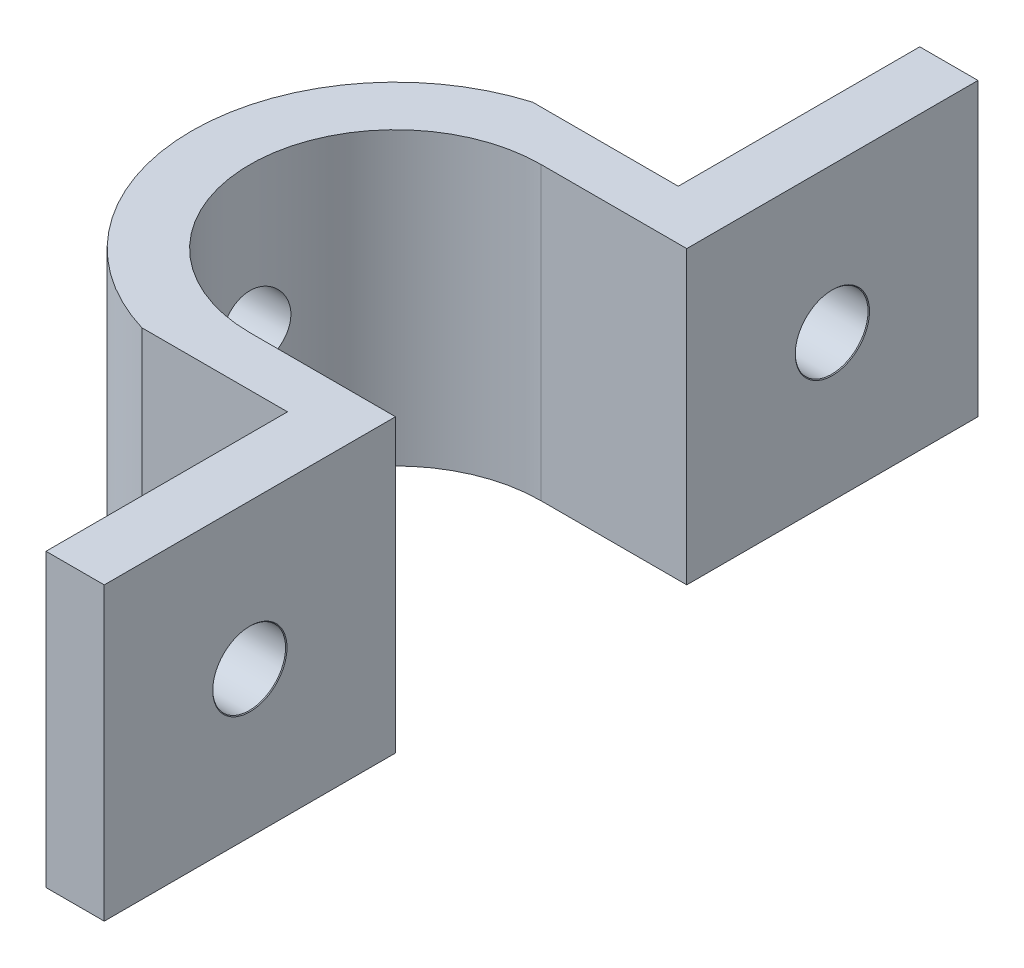
from build123d import *

# Parameters (mm, degrees)
EXTRUDE_1_DEPTH              = 10
HOLE_WIZARD_M3_2_D           = 2.5
HOLE_WIZARD_M3_2_CSINK_D     = 2.55
HOLE_WIZARD_M3_2_CSINK_ANGLE = 90
SKETCH_15_W                  = 10
SKETCH_15_H                  = 10
EXTRUDE_2_DEPTH              = 5
HOLE_WIZARD_M3_1_D           = 2.5
HOLE_WIZARD_M3_1_CSINK_D     = 2.55
HOLE_WIZARD_M3_1_CSINK_ANGLE = 90
SKETCH_21_W                  = 8.291796068
SKETCH_21_H                  = 10
CUT_EXTRUDE_2_DEPTH          = 5


with BuildPart() as part:
    # 草图1 → 凸台-拉伸1 (new body)
    with BuildSketch(Plane(origin=(0, 0, 0), x_dir=(1, 0, 0), z_dir=(0, 1, 0))):
        with BuildLine():
            Line((0, 0), (0, -10))
            ThreePointArc((0, -10), (-5, -15), (0, -20))
            Line((0, -20), (0, -30))
            Line((0, -30), (-2, -30))
            Line((-2, -30), (-2, -21.708203932))
            ThreePointArc((-2, -21.708203932), (-7, -15), (-2, -8.291796068))
            Line((-2, -8.291796068), (-2, 0))
            Line((-2, 0), (0, 0))
        make_face()
    extrude(amount=EXTRUDE_1_DEPTH)

    # M3 螺纹孔的螺纹孔钻头2 (through all)
    with Locations(Plane.ZY.offset(7)):
        with Locations((15, 5)):
            CounterSinkHole(HOLE_WIZARD_M3_2_D / 2, HOLE_WIZARD_M3_2_CSINK_D / 2, counter_sink_angle=HOLE_WIZARD_M3_2_CSINK_ANGLE)

    # 草图15 → 凸台-拉伸2 (add)
    with BuildSketch(Plane(origin=(0, 0, 0), x_dir=(0, 0, -1), z_dir=(1, 0, 0))):
        with Locations((-5, 5)):
            Rectangle(SKETCH_15_W, SKETCH_15_H)
        with Locations((-25, 5)):
            Rectangle(SKETCH_15_W, SKETCH_15_H)
    extrude(amount=EXTRUDE_2_DEPTH)

    # M3 螺纹孔的螺纹孔钻头1 (through all)
    with Locations(Plane(origin=(5, 0, 0), x_dir=(0, 0, -1), z_dir=(1, 0, 0))):
        with Locations((-5, 5), (-25, 5)):
            CounterSinkHole(HOLE_WIZARD_M3_1_D / 2, HOLE_WIZARD_M3_1_CSINK_D / 2, counter_sink_angle=HOLE_WIZARD_M3_1_CSINK_ANGLE)

    # 草图21 → 切除-拉伸2 (cut)
    with BuildSketch(Plane.ZY.offset(2)):
        with Locations((4.145898034, 5)):
            Rectangle(SKETCH_21_W, SKETCH_21_H)
        with Locations((25.854101966, 5)):
            Rectangle(SKETCH_21_W, SKETCH_21_H)
    extrude(amount=-CUT_EXTRUDE_2_DEPTH, mode=Mode.SUBTRACT)


solid = part.part
